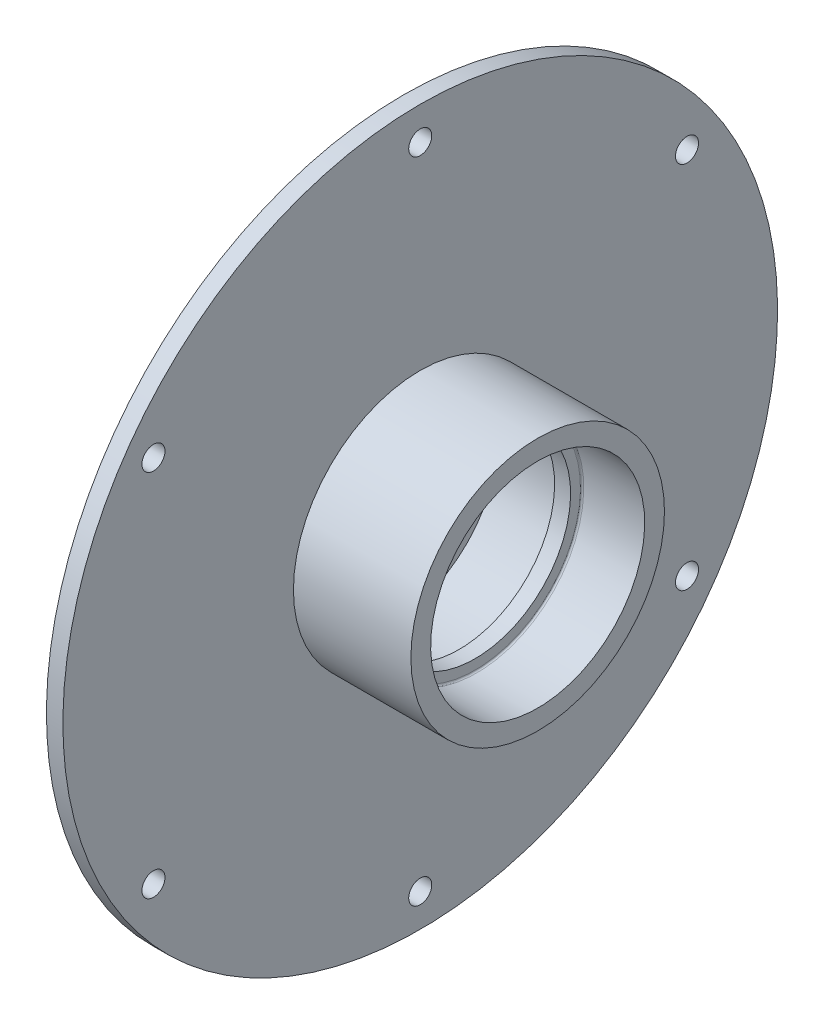
from build123d import *

# Parameters (mm, degrees)
FILLET1_R                  = 1
M16X2_0_TAPPED_HOLE1_D     = 14
M16X2_0_TAPPED_HOLE1_DEPTH = 38
M16X2_0_TAPPED_HOLE1_TIP   = 4.206024333


with BuildPart() as part:
    # Sketch1 → Revolve1 (revolve)
    with BuildSketch(Plane.XY):
        with BuildLine():
            Line((89, 65), (51, 65))
            Line((51, 65), (51, 58))
            Line((51, 58), (41.3, 58))
            Line((41.3, 58), (41.3, 65))
            Line((41.3, 65), (0, 65))
            Line((0, 65), (0, 55))
            Line((0, 55), (-5, 55))
            Line((-5, 55), (-5, 59.5))
            Line((-5, 59.5), (-15, 59.5))
            ThreePointArc((-15, 59.5), (-16.414213562, 60.085786438), (-17, 61.5))
            Line((-17, 61.5), (-17, 109.5))
            ThreePointArc((-17, 109.5), (-11.142135624, 123.642135624), (3, 129.5))
            Line((3, 129.5), (7.686032459, 129.5))
            Line((7.686032459, 129.5), (7.686032459, 217))
            Line((7.686032459, 217), (17.686032459, 217))
            Line((17.686032459, 217), (17.686032459, 77))
            Line((17.686032459, 77), (89, 77))
            Line((89, 77), (89, 65))
        make_face()
    revolve(axis=Axis((131.481481481, 0, 0), (-1, 0, 0)))

    # Fillet1
    fillet1_edges = [part.edges().sort_by_distance(p)[0] for p in [
        (41.3, -65, 0),
        (51, -65, 0),
    ]]
    fillet(fillet1_edges, radius=FILLET1_R)

    # M16x2.0 Tapped Hole1
    with Locations(Plane.ZY.offset(-7.686032459)):
        with Locations((0, 197), (0, -197), (162, -112.093710796), (-162, -112.093710796), (-162, 112.093710796), (162, 112.093710796)):
            Hole(M16X2_0_TAPPED_HOLE1_D / 2, depth=M16X2_0_TAPPED_HOLE1_DEPTH)
            with Locations((0, 0, -(M16X2_0_TAPPED_HOLE1_DEPTH + M16X2_0_TAPPED_HOLE1_TIP / 2))):  # 118° drill point
                Cone(0, M16X2_0_TAPPED_HOLE1_D / 2, M16X2_0_TAPPED_HOLE1_TIP, mode=Mode.SUBTRACT)


solid = part.part
